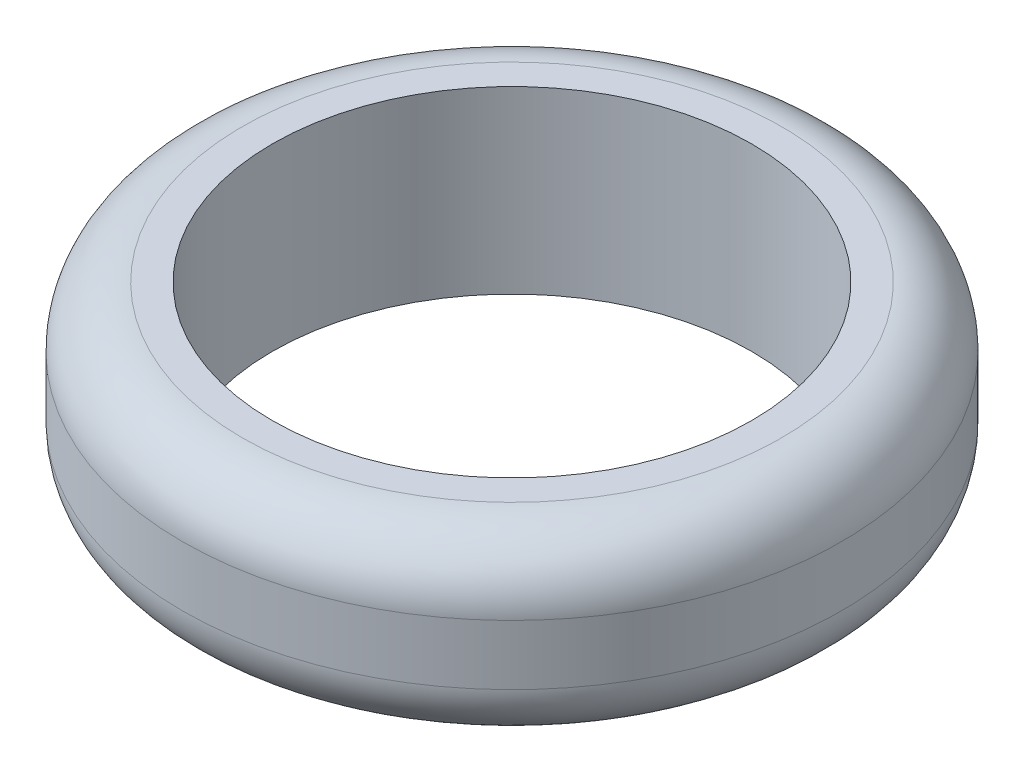
from build123d import *

# Parameters (mm, degrees)
CROQUIS1_R              = 5.5
SALIENTE_EXTRUIR1_DEPTH = 3
CROQUIS2_R              = 4
CORTAR_EXTRUIR1_DEPTH   = 5
REDONDEO1_R             = 1
REDONDEO2_R             = 1


with BuildPart() as part:
    # Croquis1 → Saliente-Extruir1 (new body)
    with BuildSketch(Plane(origin=(0, 0, 0), x_dir=(1, 0, 0), z_dir=(0, 1, 0))):
        with Locations(Location((0, 0, 0), (0, 0, 270))):
            Circle(CROQUIS1_R)
    extrude(amount=SALIENTE_EXTRUIR1_DEPTH)

    # Croquis2 → Cortar-Extruir1 (cut)
    with BuildSketch(Plane(origin=(0, 3, 0), x_dir=(1, 0, 0), z_dir=(0, 1, 0))):
        with Locations(Location((0, 0, 0), (0, 0, 270))):
            Circle(CROQUIS2_R)
    extrude(amount=-CORTAR_EXTRUIR1_DEPTH, mode=Mode.SUBTRACT)

    # Redondeo1
    redondeo1_edges = [part.edges().sort_by_distance(p)[0] for p in [
        (0, 3, -5.5),
    ]]
    fillet(redondeo1_edges, radius=REDONDEO1_R)

    # Redondeo2
    redondeo2_edges = [part.edges().sort_by_distance(p)[0] for p in [
        (0, 0, -5.5),
    ]]
    fillet(redondeo2_edges, radius=REDONDEO2_R)


solid = part.part
